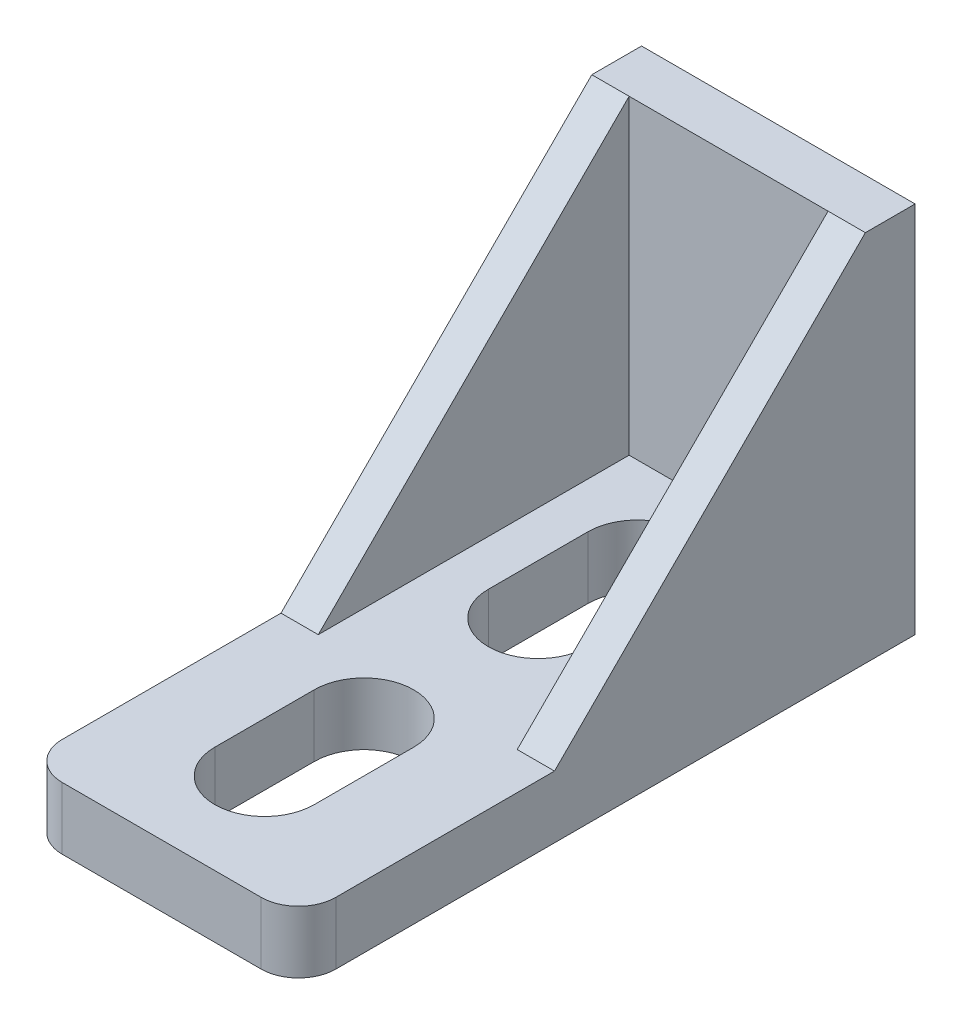
from build123d import *

# Parameters (mm, degrees)
BOSS_EXTRUDE1_DEPTH = 5
SKETCH2_W           = 22
SKETCH2_H           = 4
BOSS_EXTRUDE2_DEPTH = 30
BOSS_EXTRUDE3_START = -10.723792
BOSS_EXTRUDE3_DEPTH = 3
BOSS_EXTRUDE4_START = 11.276208
BOSS_EXTRUDE4_DEPTH = 3
FILLET1_R           = 3


with BuildPart() as part:
    # Sketch1 → Boss-Extrude1 (new body)
    with BuildSketch(Plane(origin=(0, 0, 0), x_dir=(1, 0, 0), z_dir=(0, 1, 0))):
        Polygon((0.27620797, 14.279620853), (11.27620797, 14.279620853), (11.27620797, -35.310215712), (-10.72379203, -35.310215712), (-10.72379203, 14.279620853), align=None)
        with BuildLine():
            Line((-4.048192251, -4.720379147), (-4.048192251, 3.279620853))
            ThreePointArc((-4.048192251, 3.279620853), (-0.048192251, 7.279620853), (3.951807749, 3.279620853))
            Line((3.951807749, 3.279620853), (3.951807749, -4.720379147))
            ThreePointArc((3.951807749, -4.720379147), (-0.048192251, -8.720379147), (-4.048192251, -4.720379147))
        make_face(mode=Mode.SUBTRACT)
        with BuildLine():
            Line((-4.048192251, -26.720379147), (-4.048192251, -18.720379147))
            ThreePointArc((-4.048192251, -18.720379147), (-0.048192251, -14.720379147), (3.951807749, -18.720379147))
            Line((3.951807749, -18.720379147), (3.951807749, -26.720379147))
            ThreePointArc((3.951807749, -26.720379147), (-0.048192251, -30.720379147), (-4.048192251, -26.720379147))
        make_face(mode=Mode.SUBTRACT)
    extrude(amount=BOSS_EXTRUDE1_DEPTH)

    # Sketch2 → Boss-Extrude2 (add)
    with BuildSketch(Plane(origin=(0, 0, 0), x_dir=(1, 0, 0), z_dir=(0, 1, 0))):
        with Locations((0.27620797, 12.279620853)):
            Rectangle(SKETCH2_W, SKETCH2_H)
    extrude(amount=BOSS_EXTRUDE2_DEPTH)

    # Sketch6 → Boss-Extrude3 (add)
    with BuildSketch(Plane(origin=(0, 0, 0), x_dir=(0, 0, -1), z_dir=(1, 0, 0)).offset(BOSS_EXTRUDE3_START)):
        Polygon((10.279620853, 30), (10.279620853, 5), (-14.720379147, 5), align=None)
    extrude(amount=BOSS_EXTRUDE3_DEPTH)

    # Sketch6<2> → Boss-Extrude4 (add)
    with BuildSketch(Plane(origin=(0, 0, 0), x_dir=(0, 0, -1), z_dir=(1, 0, 0)).offset(BOSS_EXTRUDE4_START)):
        Polygon((10.279620853, 30), (10.279620853, 5), (-14.720379147, 5), align=None)
    extrude(amount=-BOSS_EXTRUDE4_DEPTH)

    # Fillet1
    fillet1_edges = [part.edges().sort_by_distance(p)[0] for p in [
        (11.27620797, 2.5, 35.310215712),
        (-10.72379203, 2.5, 35.310215712),
    ]]
    fillet(fillet1_edges, radius=FILLET1_R)


solid = part.part
